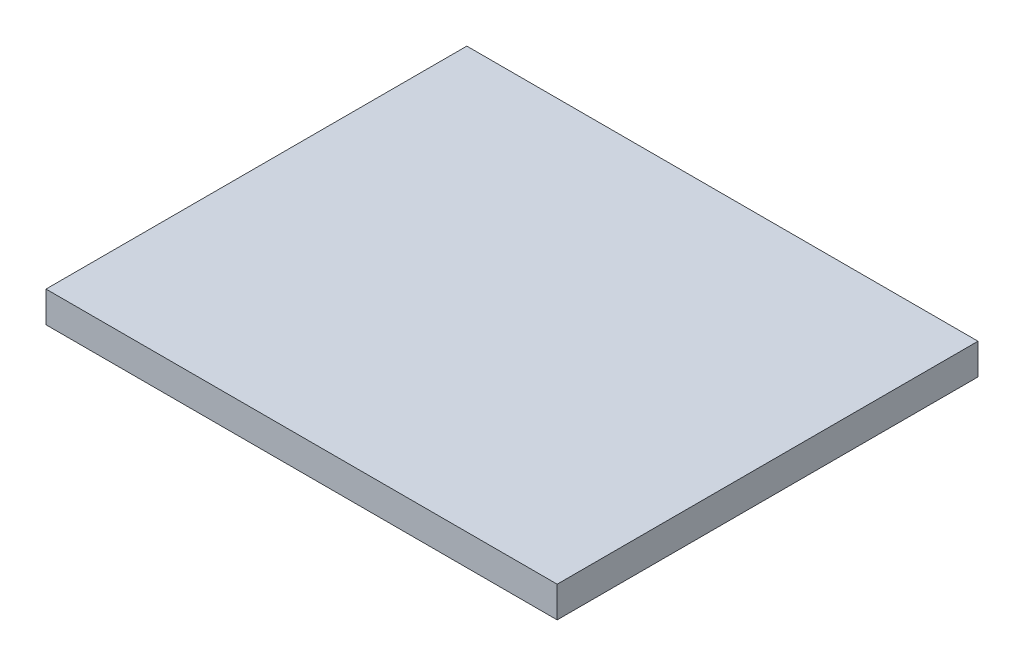
from build123d import *

# Parameters (mm, degrees)
SKETCH1_W           = 413
SKETCH1_H           = 340
BOSS_EXTRUDE1_DEPTH = 25


with BuildPart() as part:
    # Sketch1 → Boss-Extrude1 (new body)
    with BuildSketch(Plane(origin=(0, 0, 0), x_dir=(1, 0, 0), z_dir=(0, 1, 0))):
        Rectangle(SKETCH1_W, SKETCH1_H)
    extrude(amount=BOSS_EXTRUDE1_DEPTH)


solid = part.part
